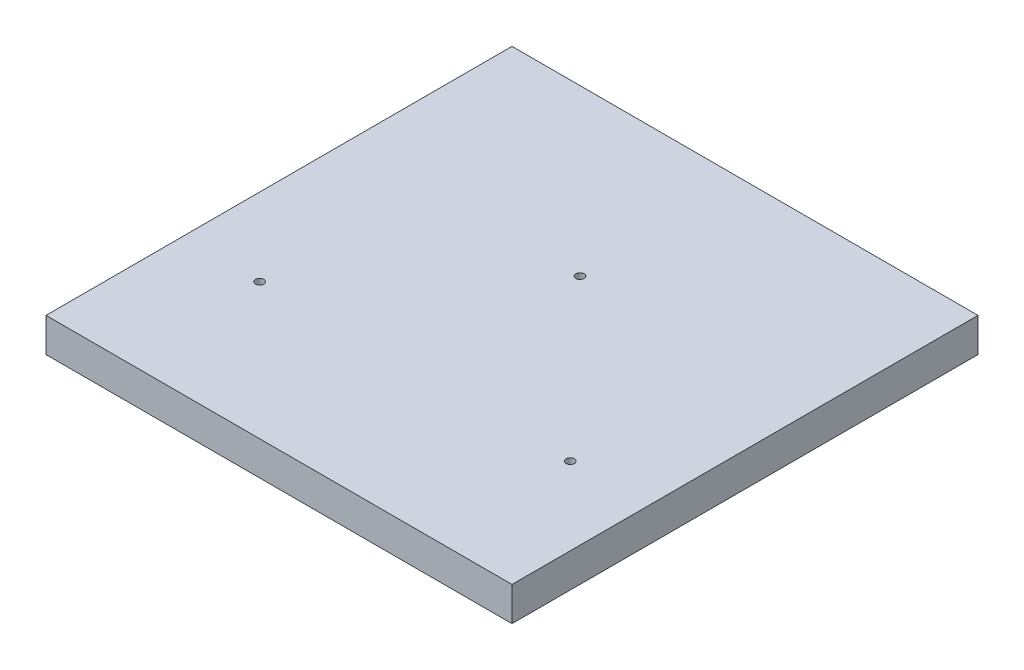
from build123d import *

# Parameters (mm, degrees)
SKETCH3_W             = 152.4
SKETCH3_H             = 11.1125
BOSS_EXTRUDE1_DEPTH   = 76.2
F_6_32_TAPPED_HOLE1_D = 2.7051


with BuildPart() as part:
    # Sketch3 → Boss-Extrude1 (new, symmetric)
    with BuildSketch(Plane.XY):
        Rectangle(SKETCH3_W, SKETCH3_H)
    extrude(amount=BOSS_EXTRUDE1_DEPTH, both=True)

    # #6-32 Tapped Hole1 (through all)
    with Locations(Plane(origin=(0, 5.55625, 0), x_dir=(1, 0, 0), z_dir=(0, 1, 0))):
        with Locations((0, 22.223542588), (50.8, -31.75), (-50.8, -31.75)):
            Hole(F_6_32_TAPPED_HOLE1_D / 2)


solid = part.part
